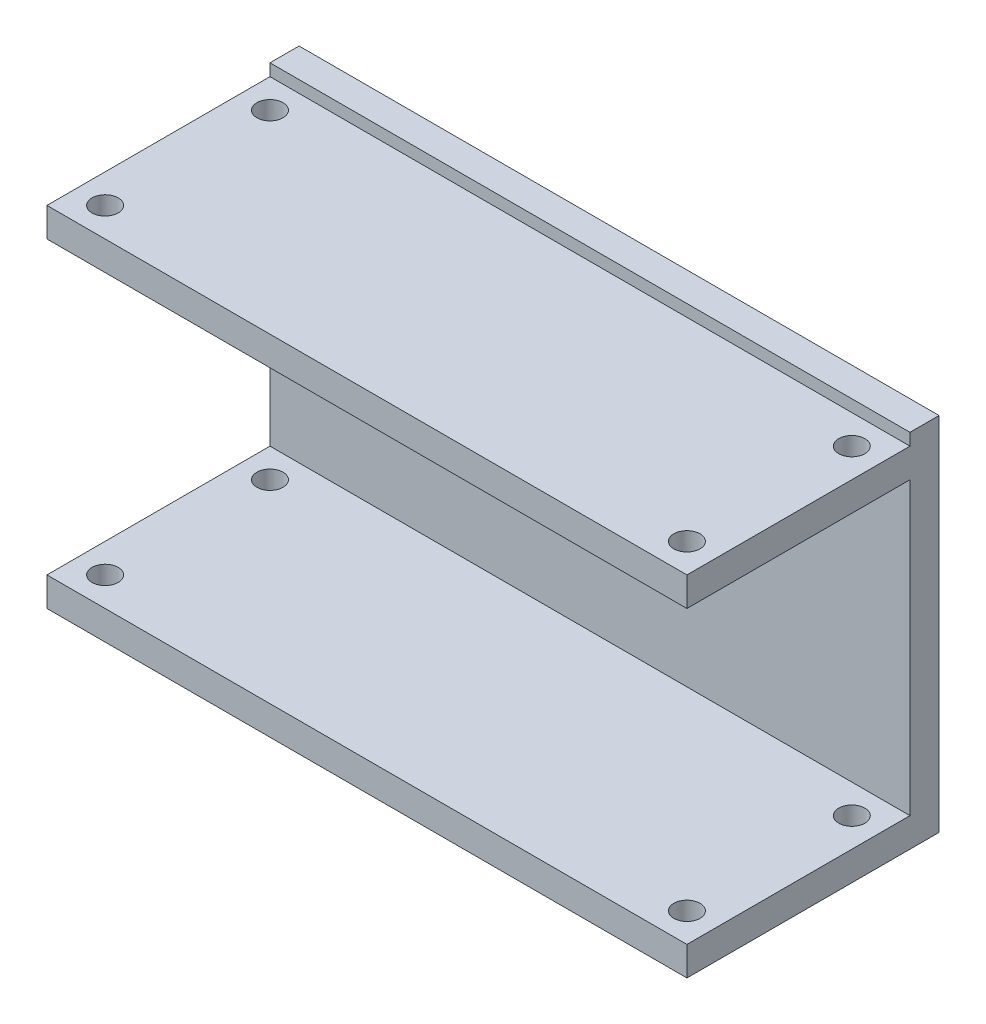
from build123d import *

# Parameters (mm, degrees)
SKETCH1_W           = 66
SKETCH1_H           = 23
SKETCH1_R           = 1.35
BOSS_EXTRUDE1_DEPTH = 3
SKETCH2_W           = 66
SKETCH2_H           = 37.236421537
BOSS_EXTRUDE2_DEPTH = 3


with BuildPart() as part:
    # Sketch1 → Boss-Extrude1 (new body)
    with BuildSketch(Plane(origin=(0, 0, 0), x_dir=(1, 0, 0), z_dir=(0, 1, 0))):
        Rectangle(SKETCH1_W, SKETCH1_H)
        with Locations(Location((-30, -8.5, 0), (0, 0, 270))):
            Circle(SKETCH1_R, mode=Mode.SUBTRACT)
        with Locations(Location((-30, 8.5, 0), (0, 0, 270))):
            Circle(SKETCH1_R, mode=Mode.SUBTRACT)
        with Locations(Location((30, -8.5, 0), (0, 0, 90))):
            Circle(SKETCH1_R, mode=Mode.SUBTRACT)
        with Locations(Location((30, 8.5, 0), (0, 0, 90))):
            Circle(SKETCH1_R, mode=Mode.SUBTRACT)
    boss_extrude1 = extrude(amount=BOSS_EXTRUDE1_DEPTH)

    # Sketch2 → Boss-Extrude2 (add)
    with BuildSketch(Plane(origin=(0, 0, -11.5), x_dir=(-1, 0, 0), z_dir=(0, 0, -1))):
        with Locations((0, 18.618210769)):
            Rectangle(SKETCH2_W, SKETCH2_H)
    extrude(amount=BOSS_EXTRUDE2_DEPTH)

    # Mirror2: Boss-Extrude1 across plane
    add(boss_extrude1.mirror(Plane.ZX.offset(18)))


solid = part.part
